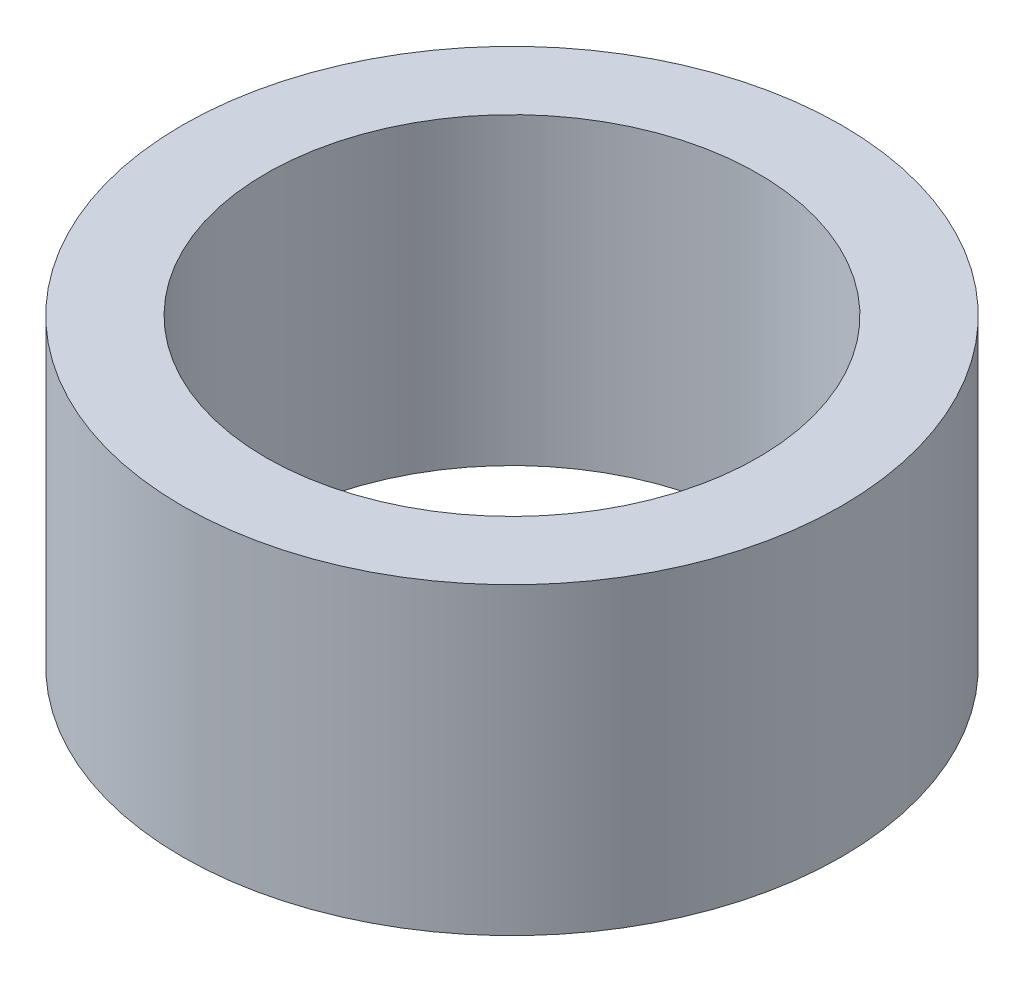
from build123d import *

# Parameters (mm, degrees)
SKETCH1_R           = 11.825
SKETCH1_R_2         = 8.825
BOSS_EXTRUDE1_DEPTH = 10.9


with BuildPart() as part:
    # Sketch1 → Boss-Extrude1 (new body)
    with BuildSketch(Plane(origin=(0, 0, 0), x_dir=(1, 0, 0), z_dir=(0, 1, 0))):
        with Locations(Location((0, 0, 0), (0, 0, 270))):
            Circle(SKETCH1_R)
        with Locations(Location((0, 0, 0), (0, 0, 270))):
            Circle(SKETCH1_R_2, mode=Mode.SUBTRACT)
    extrude(amount=-BOSS_EXTRUDE1_DEPTH)


solid = part.part
